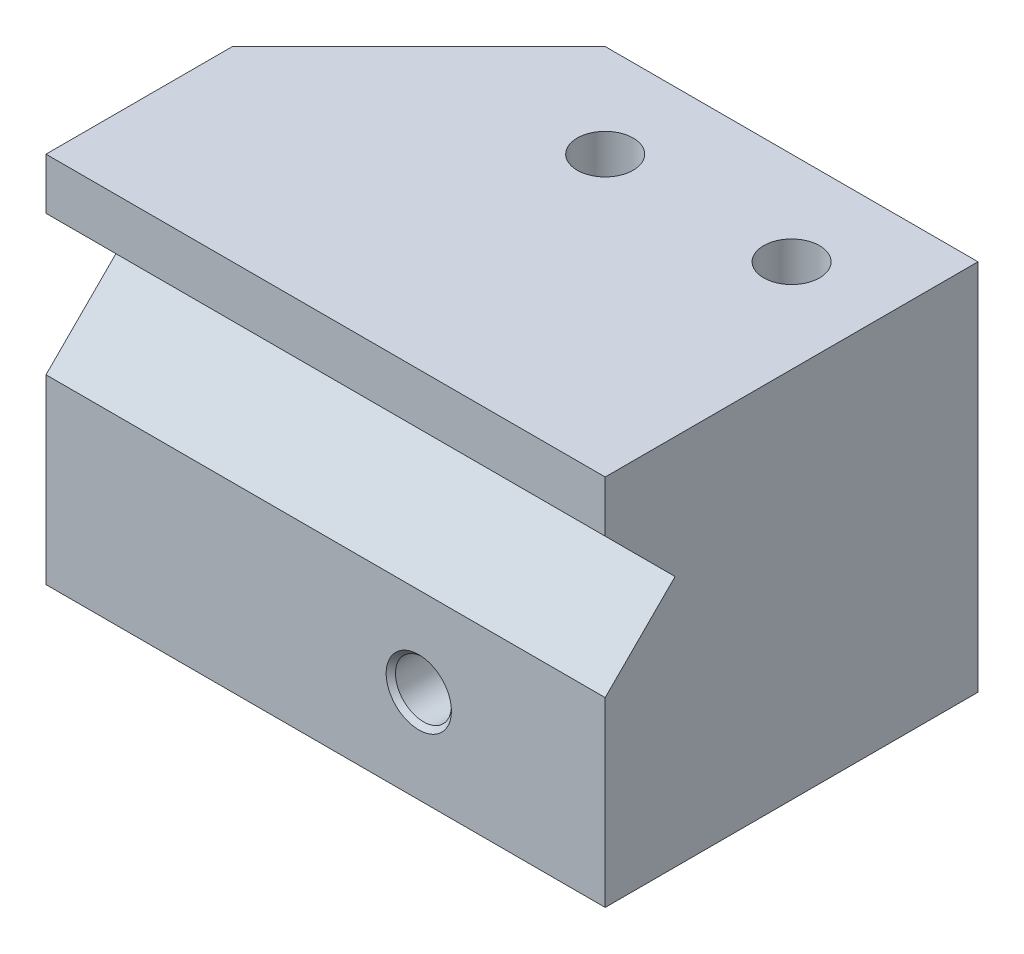
from build123d import *

# Parameters (mm, degrees)
ESQUISSE1_W           = 30
ESQUISSE1_H           = 20
EXTRUSION1_DEPTH      = 20
EXTRUSION2_DEPTH      = 38.416573868
EXTRUSION2_DEPTH_BACK = 38.416573868
ESQUISSE3_R           = 1.5
EXTRUSION3_DEPTH      = 33.015621187
CHANFREIN1_SIZE       = 10


with BuildPart() as part:
    # Esquisse1 → Extrusion1 (new body)
    with BuildSketch(Plane.XY):
        Rectangle(ESQUISSE1_W, ESQUISSE1_H)
    extrude(amount=EXTRUSION1_DEPTH)

    # Esquisse2 → Extrusion2 (cut, two sides: drawn at the far end of the back side and taken through both)
    with BuildSketch(Plane.ZY.offset(15).offset(-EXTRUSION2_DEPTH_BACK)):
        Polygon((64.422439942, 51.672439942), (20, 7.25), (16.25, 3.5), (20, -0.25), (64.422439942, -44.672439942), (190.068074021, -44.672439942), (190.068074021, 51.672439942), align=None)
    extrude(amount=EXTRUSION2_DEPTH + EXTRUSION2_DEPTH_BACK, mode=Mode.SUBTRACT)

    # Esquisse3 → Extrusion3 (cut, through all)
    with BuildSketch(Plane(origin=(0, 10, 0), x_dir=(1, 0, 0), z_dir=(0, 1, 0))):
        with Locations(Location((10, -5, 0), (0, 0, 270))):
            Circle(ESQUISSE3_R)
        with Locations(Location((0, -5, 0), (0, 0, 270))):
            Circle(ESQUISSE3_R)
    extrude(amount=-EXTRUSION3_DEPTH, mode=Mode.SUBTRACT)

    # Chanfrein1
    chanfrein1_edges = [part.edges().sort_by_distance(p)[0] for p in [
        (-15, 0, 0),
    ]]
    chamfer(chanfrein1_edges, length=CHANFREIN1_SIZE)

    # Esquisse4 → Trou taraudé M31 (revolve, cut)
    with BuildSketch(Plane(origin=(5, -5, 20), x_dir=(0, -1, 0), z_dir=(1, 0, 0))):
        Polygon((0, 0), (0, 20), (1.75, 20), (1.5, 19.75), (1.5, 0.25), (1.75, 0), align=None)
    revolve(axis=Axis((5, -5, 26.35), (0, 0, -1)), mode=Mode.SUBTRACT)


solid = part.part
